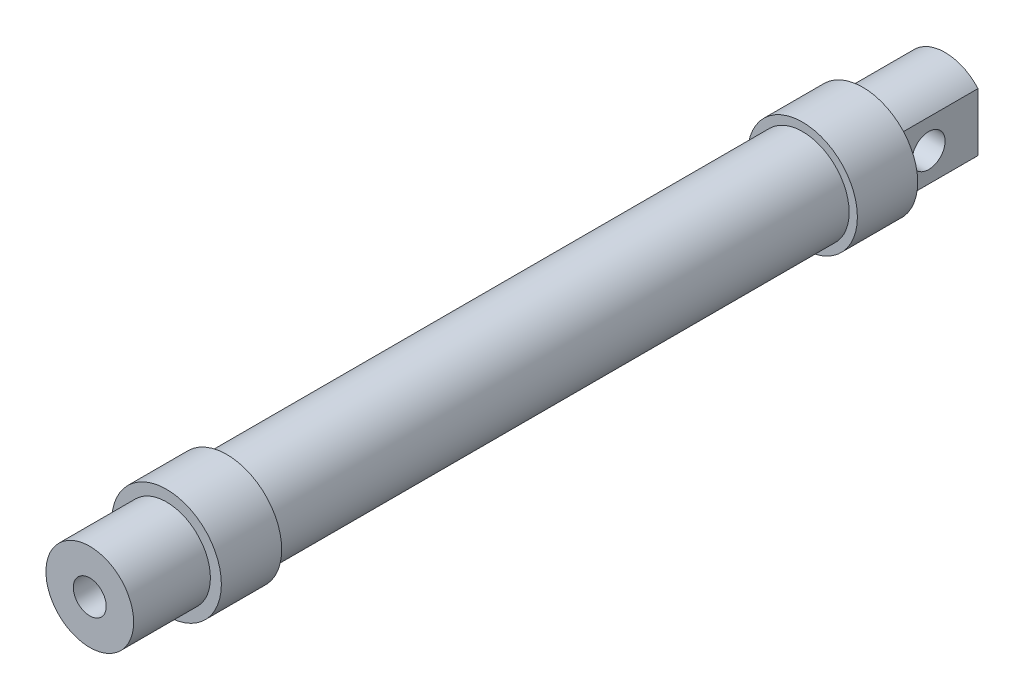
from build123d import *

# Parameters (mm, degrees)
EXTRUDE_1_DEPTH     = 15
SKETCH_2_R          = 3
CUT_EXTRUDE_1_DEPTH = 21.808652047
SKETCH_3_R          = 10
EXTRUDE_2_DEPTH     = 11
SKETCH_4_R          = 2.5
CUT_EXTRUDE_3_DEPTH = 10
SKETCH_5_R          = 8.5
SKETCH_5_R_2        = 8
EXTRUDE_4_DEPTH     = 105
SKETCH_6_R          = 10
EXTRUDE_5_DEPTH     = 11
SKETCH_7_R          = 2.5
CUT_EXTRUDE_4_DEPTH = 10
SKETCH_8_R          = 8
EXTRUDE_6_DEPTH     = 14
SKETCH_9_R          = 3
CUT_EXTRUDE_5_DEPTH = 100


with BuildPart() as part:
    # 草图1 → 凸台-拉伸1 (new body)
    with BuildSketch(Plane.XY):
        with BuildLine():
            ThreePointArc((0, 8), (-3.291502622, 7.291502622), (-6, 5.291502622))
            Line((-6, 5.291502622), (-6, -5.291502622))
            ThreePointArc((-6, -5.291502622), (-3.291502622, -7.291502622), (0, -8))
            Line((0, -8), (0, 8))
        make_face()
        with BuildLine():
            ThreePointArc((6, 5.291502622), (3.291502622, 7.291502622), (0, 8))
            Line((0, 8), (0, -8))
            ThreePointArc((0, -8), (3.291502622, -7.291502622), (6, -5.291502622))
            Line((6, -5.291502622), (6, 5.291502622))
        make_face()
    extrude(amount=EXTRUDE_1_DEPTH)

    # 草图2 → 切除-拉伸1 (cut, through all)
    with BuildSketch(Plane.ZY.offset(6)):
        with Locations((9, 0)):
            Circle(SKETCH_2_R)
    extrude(amount=-CUT_EXTRUDE_1_DEPTH, mode=Mode.SUBTRACT)

    # 草图3 → 凸台-拉伸2 (add)
    with BuildSketch(Plane.XY.offset(15)):
        Circle(SKETCH_3_R)
    extrude(amount=EXTRUDE_2_DEPTH)

    # 草图4 → 切除-拉伸3 (cut)
    with BuildSketch(Plane(origin=(0, 0, 0), x_dir=(1, 0, 0), z_dir=(0, 1, 0))):
        with Locations(Location((0, -20.5, 0), (0, 0, 270))):
            Circle(SKETCH_4_R)
    extrude(amount=-CUT_EXTRUDE_3_DEPTH, mode=Mode.SUBTRACT)

    # 草图5 → 凸台-拉伸4 (add)
    with BuildSketch(Plane.XY.offset(26)):
        Circle(SKETCH_5_R)
        Circle(SKETCH_5_R_2, mode=Mode.SUBTRACT)
    extrude(amount=EXTRUDE_4_DEPTH)

    # 草图6 → 凸台-拉伸5 (add)
    with BuildSketch(Plane.XY.offset(131)):
        Circle(SKETCH_6_R)
    extrude(amount=EXTRUDE_5_DEPTH)

    # 草图7 → 切除-拉伸4 (cut)
    with BuildSketch(Plane(origin=(0, 0, 0), x_dir=(1, 0, 0), z_dir=(0, 1, 0))):
        with Locations(Location((0, -136.5, 0), (0, 0, 270))):
            Circle(SKETCH_7_R)
    extrude(amount=-CUT_EXTRUDE_4_DEPTH, mode=Mode.SUBTRACT)

    # 草图8 → 凸台-拉伸6 (add)
    with BuildSketch(Plane.XY.offset(142)):
        Circle(SKETCH_8_R)
    extrude(amount=EXTRUDE_6_DEPTH)

    # 草图9 → 切除-拉伸5 (cut)
    with BuildSketch(Plane.XY.offset(156)):
        Circle(SKETCH_9_R)
    extrude(amount=-CUT_EXTRUDE_5_DEPTH, mode=Mode.SUBTRACT)


solid = part.part
